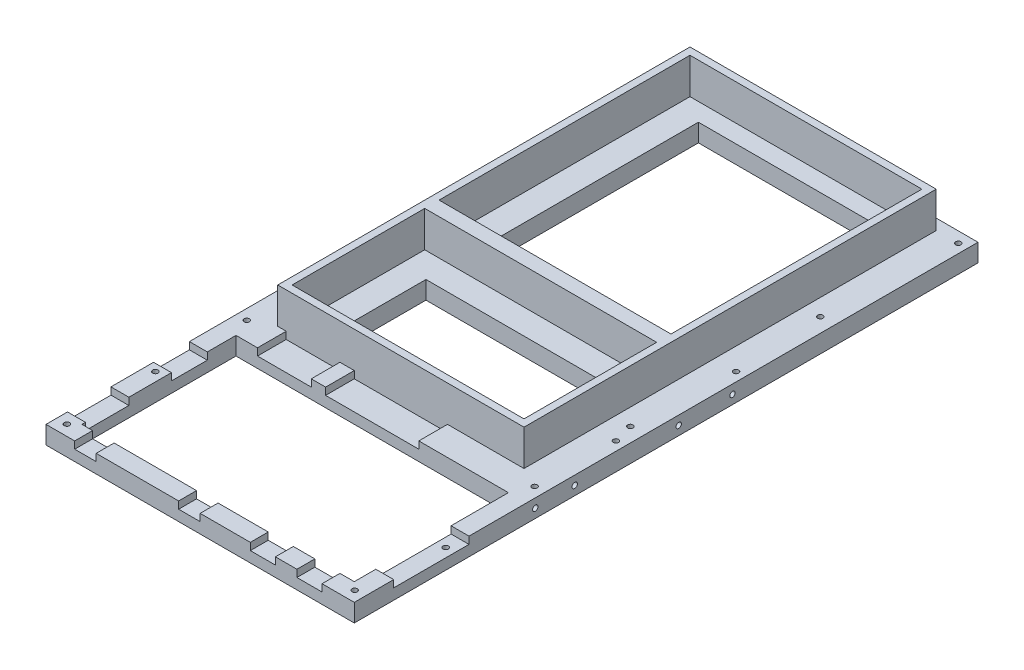
from build123d import *

# Parameters (mm, degrees)
SKETCH_1_W          = 86
SKETCH_1_H          = 174
SKETCH_1_W_2        = 50
SKETCH_1_H_2        = 25
SKETCH_1_H_3        = 55
SKETCH_1_W_3        = 76
SKETCH_1_H_4        = 43
EXTRUDE_1_DEPTH     = 5
SKETCH_4_W          = 68.7
SKETCH_4_H          = 115
SKETCH_4_W_2        = 64.7
SKETCH_4_H_2        = 37
SKETCH_4_H_3        = 70
EXTRUDE_2_DEPTH     = 10
SKETCH_5_R          = 0.75
CUT_EXTRUDE_1_DEPTH = 122.783619588
SKETCH_7_W          = 15
SKETCH_7_H          = 8
SKETCH_7_W_2        = 26
SKETCH_7_W_3        = 5
SKETCH_7_H_2        = 10
SKETCH_7_H_3        = 12.119700025
SKETCH_7_W_4        = 6
SKETCH_7_H_4        = 5
SKETCH_7_W_5        = 7
SKETCH_7_H_5        = 21
CUT_EXTRUDE_2_DEPTH = 2
SKETCH_8_R          = 0.75
CUT_EXTRUDE_3_DEPTH = 2
CUT_EXTRUDE_START   = -84
SKETCH_8_3_R        = 0.75
CUT_EXTRUDE_4_DEPTH = 2


with BuildPart() as part:
    # 草图1 → 凸台-拉伸1 (new body)
    with BuildSketch(Plane(origin=(0, 0, 0), x_dir=(1, 0, 0), z_dir=(0, 1, 0))):
        with Locations((0, -26.5)):
            Rectangle(SKETCH_1_W, SKETCH_1_H)
        with Locations((0, -38)):
            Rectangle(SKETCH_1_W_2, SKETCH_1_H_2, mode=Mode.SUBTRACT)
        with Locations((0, 23)):
            Rectangle(SKETCH_1_W_2, SKETCH_1_H_3, mode=Mode.SUBTRACT)
        with Locations((0, -87)):
            Rectangle(SKETCH_1_W_3, SKETCH_1_H_4, mode=Mode.SUBTRACT)
    extrude(amount=EXTRUDE_1_DEPTH)

    # 草图4 → 凸台-拉伸2 (add)
    with BuildSketch(Plane(origin=(0, 5, 0), x_dir=(1, 0, 0), z_dir=(0, 1, 0))):
        Rectangle(SKETCH_4_W, SKETCH_4_H)
        with Locations((0, -37)):
            Rectangle(SKETCH_4_W_2, SKETCH_4_H_2, mode=Mode.SUBTRACT)
        with Locations((0, 20.5)):
            Rectangle(SKETCH_4_W_2, SKETCH_4_H_3, mode=Mode.SUBTRACT)
    extrude(amount=EXTRUDE_2_DEPTH)

    # 草图5 → 切除-拉伸1 (cut, through all)
    with BuildSketch(Plane(origin=(0, 5, 0), x_dir=(1, 0, 0), z_dir=(0, 1, 0))):
        with Locations(Location((-39, 20.5, 0), (0, 0, 270))):
            Circle(SKETCH_5_R)
        with Locations(Location((39, 20.5, 0), (0, 0, 270))):
            Circle(SKETCH_5_R)
        with Locations(Location((-39, -32.5, 0), (0, 0, 270))):
            Circle(SKETCH_5_R)
        with Locations(Location((39, -32.5, 0), (0, 0, 270))):
            Circle(SKETCH_5_R)
        with Locations(Location((-40.1427775, -60.35, 0), (0, 0, 270))):
            Circle(SKETCH_5_R)
        with Locations(Location((40.1427775, -60.35, 0), (0, 0, 270))):
            Circle(SKETCH_5_R)
        with Locations(Location((-40.1427775, -110.530299975, 0), (0, 0, 270))):
            Circle(SKETCH_5_R)
        with Locations(Location((40.1427775, -110.530299975, 0), (0, 0, 270))):
            Circle(SKETCH_5_R)
        with Locations(Location((-40.5, 57.5, 0), (0, 0, 270))):
            Circle(SKETCH_5_R)
        with Locations(Location((-40.5, -38, 0), (0, 0, 270))):
            Circle(SKETCH_5_R)
        with Locations(Location((-40.5, -85.5, 0), (0, 0, 270))):
            Circle(SKETCH_5_R)
        with Locations(Location((40.5, 57.5, 0), (0, 0, 270))):
            Circle(SKETCH_5_R)
        with Locations(Location((40.5, -38, 0), (0, 0, 270))):
            Circle(SKETCH_5_R)
        with Locations(Location((40.5, -85.5, 0), (0, 0, 270))):
            Circle(SKETCH_5_R)
        with Locations(Location((-40.5, -4.5, 0), (0, 0, 270))):
            Circle(SKETCH_5_R)
        with Locations(Location((40.5, -4.5, 0), (0, 0, 270))):
            Circle(SKETCH_5_R)
    extrude(amount=-CUT_EXTRUDE_1_DEPTH, mode=Mode.SUBTRACT)

    # 草图7 → 切除-拉伸2 (cut)
    with BuildSketch(Plane(origin=(0, 5, 0), x_dir=(1, 0, 0), z_dir=(0, 1, 0))):
        with Locations((-24.5, -61.5)):
            Rectangle(SKETCH_7_W, SKETCH_7_H)
        with Locations((0, -61.5)):
            Rectangle(SKETCH_7_W_2, SKETCH_7_H)
        with Locations((-40.5, -78.5)):
            Rectangle(SKETCH_7_W_3, SKETCH_7_H_2)
        with Locations((-40.5, -101.440149988)):
            Rectangle(SKETCH_7_W_3, SKETCH_7_H_3)
        with Locations((-32, -111)):
            Rectangle(SKETCH_7_W_4, SKETCH_7_H_4)
        with Locations((-3, -111)):
            Rectangle(SKETCH_7_W_4, SKETCH_7_H_4)
        with Locations((17.5, -111)):
            Rectangle(SKETCH_7_W_5, SKETCH_7_H_4)
        with Locations((30.5, -111)):
            Rectangle(SKETCH_7_W_5, SKETCH_7_H_4)
        with Locations((40.5, -92)):
            Rectangle(SKETCH_7_W_3, SKETCH_7_H_5)
    extrude(amount=-CUT_EXTRUDE_2_DEPTH, mode=Mode.SUBTRACT)

    # 草图8 → 切除-拉伸3 (cut)
    with BuildSketch(Plane.ZY.offset(43)):
        with Locations((8, 2.5)):
            Circle(SKETCH_8_R)
        with Locations((23, 2.5)):
            Circle(SKETCH_8_R)
        with Locations((52, 2.5)):
            Circle(SKETCH_8_R)
        with Locations((63, 2.5)):
            Circle(SKETCH_8_R)
    extrude(amount=-CUT_EXTRUDE_3_DEPTH, mode=Mode.SUBTRACT)

    # 草图8<3> → 切除-拉伸4 (cut)
    with BuildSketch(Plane.ZY.offset(43).offset(CUT_EXTRUDE_START)):
        with Locations((8, 2.5)):
            Circle(SKETCH_8_3_R)
        with Locations((23, 2.5)):
            Circle(SKETCH_8_3_R)
        with Locations((52, 2.5)):
            Circle(SKETCH_8_3_R)
        with Locations((63, 2.5)):
            Circle(SKETCH_8_3_R)
    extrude(amount=-CUT_EXTRUDE_4_DEPTH, mode=Mode.SUBTRACT)


solid = part.part
